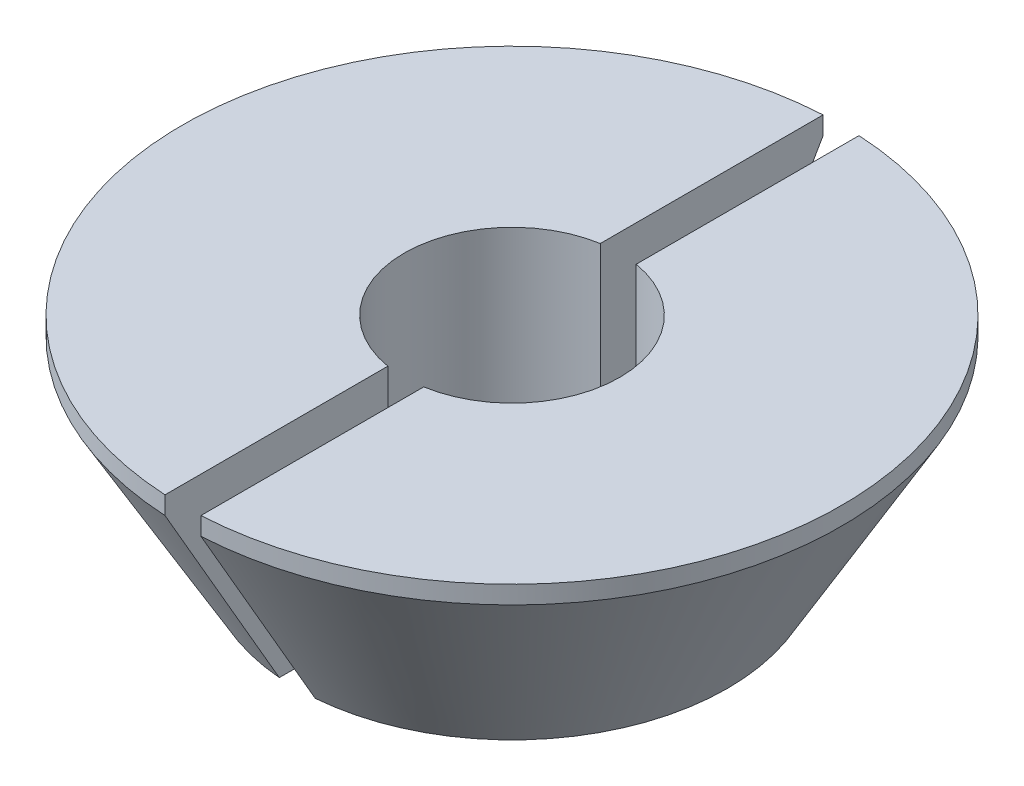
from build123d import *

# Parameters (mm, degrees)
CUT_EXTRUDE1_DEPTH      = 8.148022492
CUT_EXTRUDE1_DEPTH_BACK = 8.148022492
SKETCH2_W               = 0.5
SKETCH2_H               = 6


with BuildPart() as part:
    # Sketch1 → Revolve1 (revolve)
    with BuildSketch(Plane.XY, mode=Mode.PRIVATE) as revolve1_sk:
        Polygon((3, 0), (4.58771324, 2.75), (4.58771324, 3), (1.5, 3), (1.5, 0), align=None)
    revolve(revolve1_sk.sketch.rotate(Axis((0, 0, 0), (0, 1, 0)), 90), axis=Axis((0, 0, 0), (0, 1, 0)))

    # Sketch2 → Cut-Extrude1 (cut, two sides: drawn at the far end of the back side and taken through both)
    with BuildSketch(Plane.XY.offset(-CUT_EXTRUDE1_DEPTH_BACK)):
        Rectangle(SKETCH2_W, SKETCH2_H)
    extrude(amount=CUT_EXTRUDE1_DEPTH + CUT_EXTRUDE1_DEPTH_BACK, mode=Mode.SUBTRACT)


with BuildPart() as cut_extrude1_piece_1:
    # of the separate pieces the step leaves, piece 1, a body of its own (cut_extrude1_pieces)
    add(part.part.solids().sort_by_distance((-0.25, 0, -2.989565186))[0])


with BuildPart() as cut_extrude1_piece_2:
    # of the separate pieces the step leaves, piece 2, a body of its own (cut_extrude1_pieces)
    add(part.part.solids().sort_by_distance((0.25, 0, 2.989565186))[0])


solid = Compound([cut_extrude1_piece_1.part, cut_extrude1_piece_2.part])
